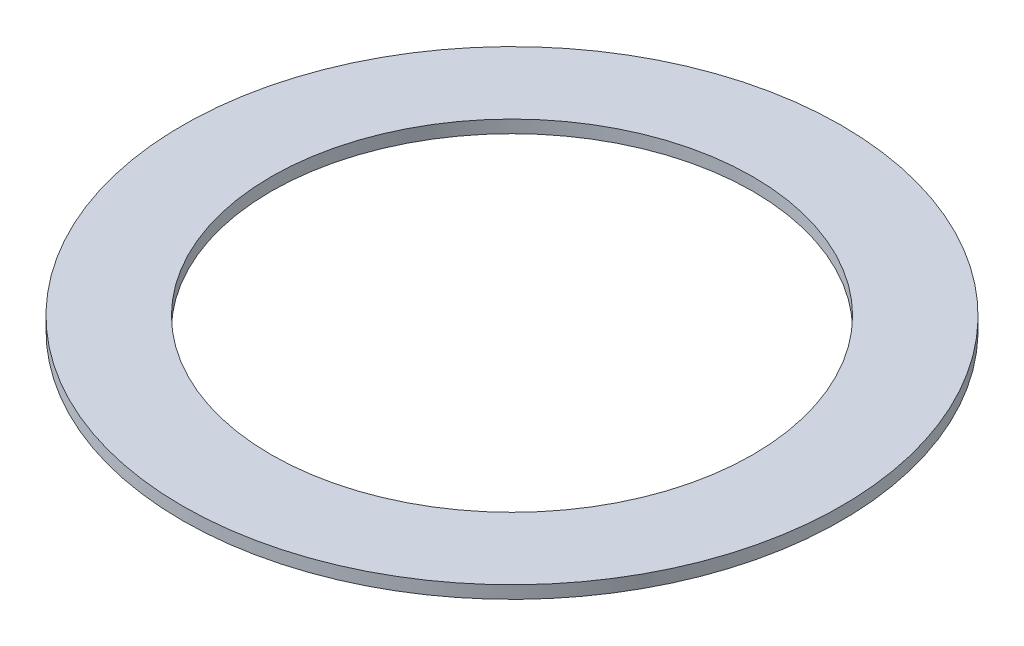
from build123d import *

# Parameters (mm, degrees)
SKETCH1_R           = 13
SKETCH1_R_2         = 9.5
BOSS_EXTRUDE1_DEPTH = 0.5


with BuildPart() as part:
    # Sketch1 → Boss-Extrude1 (new body)
    with BuildSketch(Plane(origin=(0, 0, 0), x_dir=(1, 0, 0), z_dir=(0, 1, 0))):
        with Locations(Location((0, 0, 0), (0, 0, 270))):
            Circle(SKETCH1_R)
        with Locations(Location((0, 0, 0), (0, 0, 270))):
            Circle(SKETCH1_R_2, mode=Mode.SUBTRACT)
    extrude(amount=BOSS_EXTRUDE1_DEPTH)


solid = part.part
